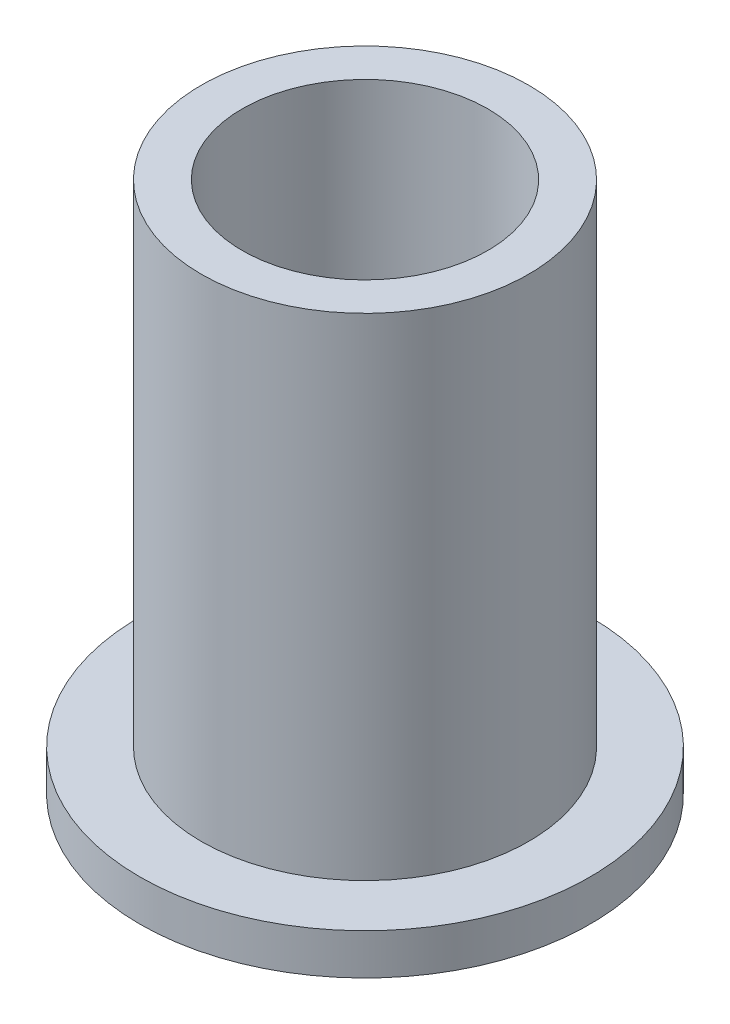
from build123d import *


with BuildPart() as part:
    # Sketch1 → Revolve1 (revolve)
    with BuildSketch(Plane.XY, mode=Mode.PRIVATE) as revolve1_sk:
        Polygon((4.7625, 0), (4.7625, 20.6375), (6.35, 20.6375), (6.35, 1.5875), (8.73125, 1.5875), (8.73125, 0), align=None)
    revolve(revolve1_sk.sketch.rotate(Axis((0, 0, 0), (0, 1, 0)), 90), axis=Axis((0, 0, 0), (0, 1, 0)))


solid = part.part
